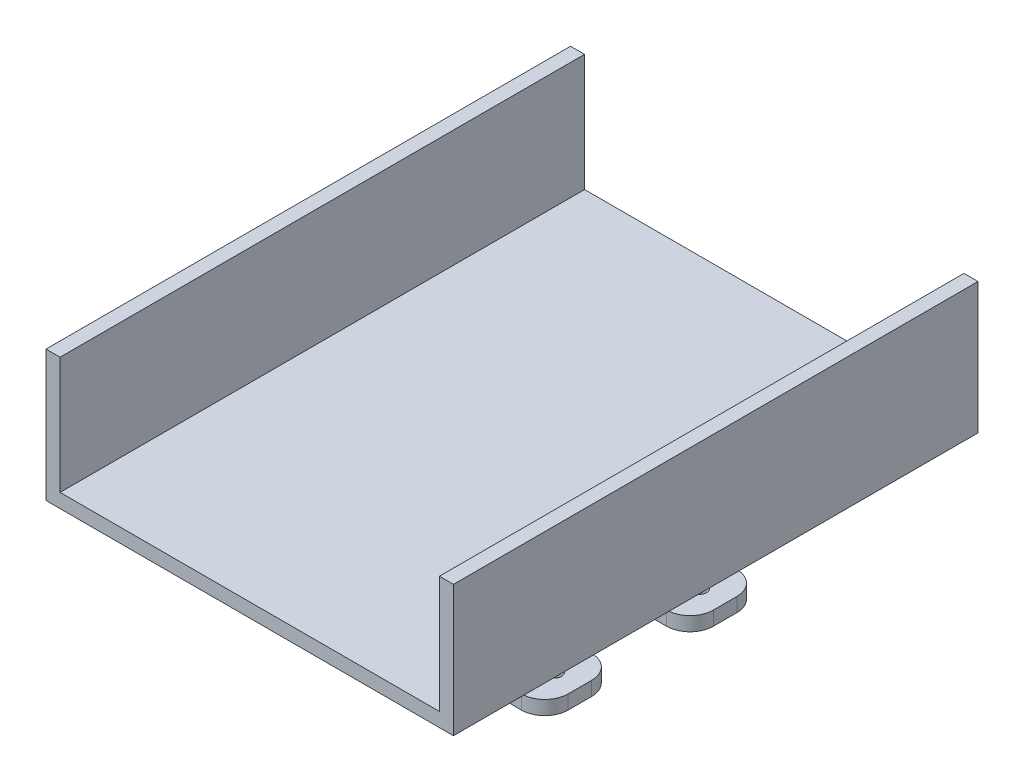
from build123d import *

# Parameters (mm, degrees)
SKETCH1_W             = 87
SKETCH1_H             = 112
BOSS_EXTRUDE1_DEPTH   = 3
SKETCH2_W             = 38
SKETCH2_H             = 3
BOSS_EXTRUDE2_DEPTH   = 18
SKETCH8_W             = 60
SKETCH8_H             = 15
SKETCH8_R             = 1.575
SKETCH8_W_2           = 38
SKETCH8_H_2           = 3
BOSS_EXTRUDE5_DEPTH   = 3
BOSS_EXTRUDE5_2_DEPTH = 3
SKETCH9_W             = 38
SKETCH9_H             = 3
BOSS_EXTRUDE6_DEPTH   = 3
SKETCH10_W            = 38
SKETCH10_H            = 3
BOSS_EXTRUDE7_DEPTH   = 3
FILLET2_R             = 5
FILLET3_R             = 5
FILLET4_R             = 5
SKETCH12_W            = 3
SKETCH12_H            = 112
BOSS_EXTRUDE8_DEPTH   = 25


with BuildPart() as part:
    # Sketch1 → Boss-Extrude1 (new body)
    with BuildSketch(Plane(origin=(0, 0, 0), x_dir=(1, 0, 0), z_dir=(0, 1, 0))):
        Rectangle(SKETCH1_W, SKETCH1_H)
    extrude(amount=BOSS_EXTRUDE1_DEPTH)

    # Sketch2 → Boss-Extrude2 (add)
    with BuildSketch(Plane.XZ):
        with Locations((0, -15.5)):
            Rectangle(SKETCH2_W, SKETCH2_H)
        with Locations((0, 15.5)):
            Rectangle(SKETCH2_W, SKETCH2_H)
    extrude(amount=BOSS_EXTRUDE2_DEPTH)



with BuildPart() as body_2:
    # Sketch8 → Boss-Extrude5 (new body)
    with BuildSketch(Plane.XZ.offset(18)):
        with Locations((0, 15.5)):
            Rectangle(SKETCH8_W, SKETCH8_H)
        with Locations(Location((-24.5, 15.5, 0), (0, 0, 270))):
            Circle(SKETCH8_R, mode=Mode.SUBTRACT)
        with Locations(Location((24.5, 15.5, 0), (0, 0, 90))):
            Circle(SKETCH8_R, mode=Mode.SUBTRACT)
        with Locations((0, 15.5)):
            Rectangle(SKETCH8_W_2, SKETCH8_H_2, mode=Mode.SUBTRACT)
    extrude(amount=BOSS_EXTRUDE5_DEPTH)


with BuildPart() as body_3:
    # Sketch8 → Boss-Extrude5 2 (new body)
    with BuildSketch(Plane.XZ.offset(18)):
        with Locations((0, -15.5)):
            Rectangle(SKETCH8_W, SKETCH8_H)
        with Locations(Location((-24.5, -15.5, 0), (0, 0, 270))):
            Circle(SKETCH8_R, mode=Mode.SUBTRACT)
        with Locations(Location((24.5, -15.5, 0), (0, 0, 90))):
            Circle(SKETCH8_R, mode=Mode.SUBTRACT)
        with Locations((0, -15.5)):
            Rectangle(SKETCH8_W_2, SKETCH8_H_2, mode=Mode.SUBTRACT)
    extrude(amount=BOSS_EXTRUDE5_2_DEPTH)


with BuildPart() as part_1:
    add(part.part)

    add(body_2.part)  # Boss-Extrude6 merges body 2
    # Sketch9 → Boss-Extrude6 (add)
    with BuildSketch(Plane.XY.offset(14)):
        with Locations((0, -19.5)):
            Rectangle(SKETCH9_W, SKETCH9_H)
    extrude(amount=BOSS_EXTRUDE6_DEPTH)


    add(body_3.part)  # Boss-Extrude7 merges body 3
    # Sketch10 → Boss-Extrude7 (add)
    with BuildSketch(Plane(origin=(0, 0, -14), x_dir=(-1, 0, 0), z_dir=(0, 0, -1))):
        with Locations((0, -19.5)):
            Rectangle(SKETCH10_W, SKETCH10_H)
    extrude(amount=BOSS_EXTRUDE7_DEPTH)

    # Fillet2
    fillet2_edges = [part_1.edges().sort_by_distance(p)[0] for p in [
        (-30, -19.5, -8),
        (30, -19.5, -8),
        (30, -19.5, -23),
        (-30, -19.5, -23),
    ]]
    fillet(fillet2_edges, radius=FILLET2_R)

    # Fillet3
    fillet3_edges = [part_1.edges().sort_by_distance(p)[0] for p in [
        (-30, -19.5, 23),
        (-30, -19.5, 8),
        (30, -19.5, 8),
        (30, -19.5, 23),
    ]]
    fillet(fillet3_edges, radius=FILLET3_R)

    # Fillet4
    fillet4_edges = [part_1.edges().sort_by_distance(p)[0] for p in [
        (0, 0, 14),
        (0, 0, 17),
        (0, 0, -14),
        (0, 0, -17),
        (0, -18, -14),
        (0, -18, -17),
        (0, -18, 17),
        (0, -18, 14),
    ]]
    fillet(fillet4_edges, radius=FILLET4_R)

    # Sketch12 → Boss-Extrude8 (add)
    with BuildSketch(Plane(origin=(0, 3, 0), x_dir=(1, 0, 0), z_dir=(0, 1, 0))):
        with Locations((42, 0)):
            Rectangle(SKETCH12_W, SKETCH12_H)
        with Locations((-42, 0)):
            Rectangle(SKETCH12_W, SKETCH12_H)
    extrude(amount=BOSS_EXTRUDE8_DEPTH)


solid = part_1.part
